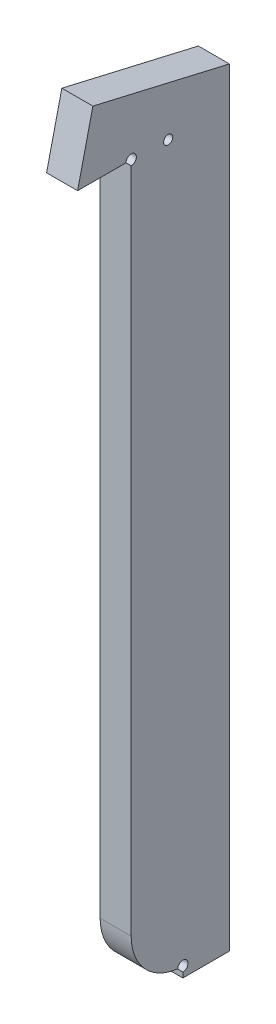
from build123d import *

# Parameters (mm, degrees)
SKETCH1_W                                        = 19.05
SKETCH1_H                                        = 450.85
BOSS_EXTRUDE1_DEPTH                              = 66.675
FILLET4_R                                        = 38.1
CUT_EXTRUDE1_REACH                               = 458.151
BOSS_EXTRUDE2_DEPTH                              = 19.05
BOSS_EXTRUDE3_DEPTH                              = 19.05
F_1_4_0_25_DIAMETER_HOLE1_D                      = 6.35
F_10_CLEARANCE_HOLE_WITH_1_0_X_25_CB_D           = 5.6134
F_10_CLEARANCE_HOLE_WITH_1_0_X_25_CB_CBORE_D     = 12.7
F_10_CLEARANCE_HOLE_WITH_1_0_X_25_CB_CBORE_DEPTH = 6.35


with BuildPart() as part:
    # Sketch1 → Boss-Extrude1 (new body)
    with BuildSketch(Plane.XY):
        with Locations((-218.563766336, -225.425)):
            Rectangle(SKETCH1_W, SKETCH1_H)
    extrude(amount=BOSS_EXTRUDE1_DEPTH)

    # Fillet4
    fillet4_edges = [part.edges().sort_by_distance(p)[0] for p in [
        (-218.563766336, -450.85, 66.675),
    ]]
    fillet(fillet4_edges, radius=FILLET4_R)

    # Sketch4 → Cut-Extrude1 (cut, up to next)
    with BuildSketch(Plane.ZY.offset(228.088766336), mode=Mode.PRIVATE) as cut_extrude1_sk1:
        with BuildLine():
            Line((66.675, 0), (66.675, -412.75))
            ThreePointArc((66.675, -412.75), (55.515768363, -439.690768363), (28.575, -450.85))
            Line((28.575, -450.85), (28.575, -444.5))
            ThreePointArc((28.575, -444.5), (51.025640303, -435.200640303), (60.325, -412.75))
            Line((60.325, -412.75), (60.325, 0))
            Line((60.325, 0), (66.675, 0))
        make_face()
    cut_extrude1_tool1 = extrude(cut_extrude1_sk1.sketch, amount=-CUT_EXTRUDE1_REACH, mode=Mode.PRIVATE) & part.part
    add(cut_extrude1_tool1.solids().sort_by_distance((-228.088766, -233.202612, 62.01827))[0], mode=Mode.SUBTRACT)

    # Sketch7 → Boss-Extrude2 (add, through all)
    with BuildSketch(Plane.ZY.offset(228.088766336)):
        Polygon((0, 0), (60.325, 0), (60.325, 34.844553242), (0, 20.824633003), align=None)
    extrude(amount=-BOSS_EXTRUDE2_DEPTH)

    # Sketch8 → Boss-Extrude3 (add, through all)
    with BuildSketch(Plane.ZY.offset(228.088766336)):
        Polygon((60.325, 34.844553242), (83.828599938, 40.306941911), (93.196193981, 0), (60.325, 0), align=None)
    extrude(amount=-BOSS_EXTRUDE3_DEPTH)

    # 1/4 (0.25) Diameter Hole1 (through all)
    with Locations(Plane.ZY.offset(228.088766336)):
        with Locations((28.575, -444.5), (60.325, 0)):
            Hole(F_1_4_0_25_DIAMETER_HOLE1_D / 2)

    # #10 Clearance Hole with 1.0 x .25 CB (through all)
    with Locations(Plane.ZY.offset(228.088766336)):
        with Locations((37.58012522, -0.660555349)):
            CounterBoreHole(F_10_CLEARANCE_HOLE_WITH_1_0_X_25_CB_D / 2, F_10_CLEARANCE_HOLE_WITH_1_0_X_25_CB_CBORE_D / 2, F_10_CLEARANCE_HOLE_WITH_1_0_X_25_CB_CBORE_DEPTH)


solid = part.part
